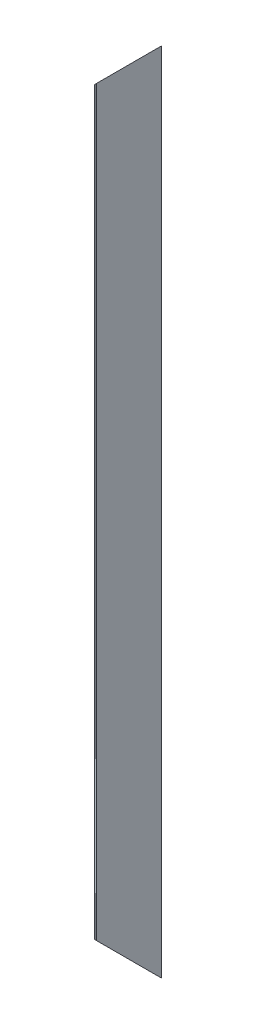
from build123d import *

# Parameters (mm, degrees)
L_ANGLE_EQUAL_40X40X3_1_DEPTH = 500
CUT_EXTRUDE3_DEPTH            = 504.189825016
CUT_EXTRUDE4_DEPTH            = 40
SKETCH19_R                    = 2
CUT_EXTRUDE5_DEPTH            = 3


with BuildPart() as part:
    # Sketch11 → L angle (equal) 40X40X3(1) (new body)
    with BuildSketch(Plane(origin=(0, 0, 0), x_dir=(-1, 0, 0), z_dir=(0, 1, 0))):
        with BuildLine():
            Line((0, 40), (0, 0))
            Line((0, 0), (40, 0))
            ThreePointArc((40, 0), (39.121320344, 2.121320344), (37, 3))
            Line((37, 3), (9, 3))
            ThreePointArc((9, 3), (4.757359313, 4.757359313), (3, 9))
            Line((3, 9), (3, 37))
            ThreePointArc((3, 37), (2.121320344, 39.121320344), (0, 40))
        make_face()
    extrude(amount=L_ANGLE_EQUAL_40X40X3_1_DEPTH)

    # Sketch17 → Cut-Extrude3 (cut, through all)
    with BuildSketch(Plane(origin=(0, 0, 0), x_dir=(-1, 0, 0), z_dir=(0, 0, -1))):
        Polygon((0, 500), (40, 460), (40, 500), align=None)
    extrude(amount=-CUT_EXTRUDE3_DEPTH, mode=Mode.SUBTRACT)

    # Sketch18 → Cut-Extrude4 (cut)
    with BuildSketch(Plane(origin=(0, 0, 0), x_dir=(0, 0, -1), z_dir=(1, 0, 0))):
        Polygon((0, 0), (-40, 40), (-40, 0), align=None)
    extrude(amount=-CUT_EXTRUDE4_DEPTH, mode=Mode.SUBTRACT)

    # Sketch19 → Cut-Extrude5 (cut)
    with BuildSketch(Plane(origin=(0, 0, 0), x_dir=(-1, 0, 0), z_dir=(0, 0, -1))):
        with Locations((20, 480)):
            Circle(SKETCH19_R)
        with Locations((20, 20)):
            Circle(SKETCH19_R)
    extrude(amount=-CUT_EXTRUDE5_DEPTH, mode=Mode.SUBTRACT)


solid = part.part
